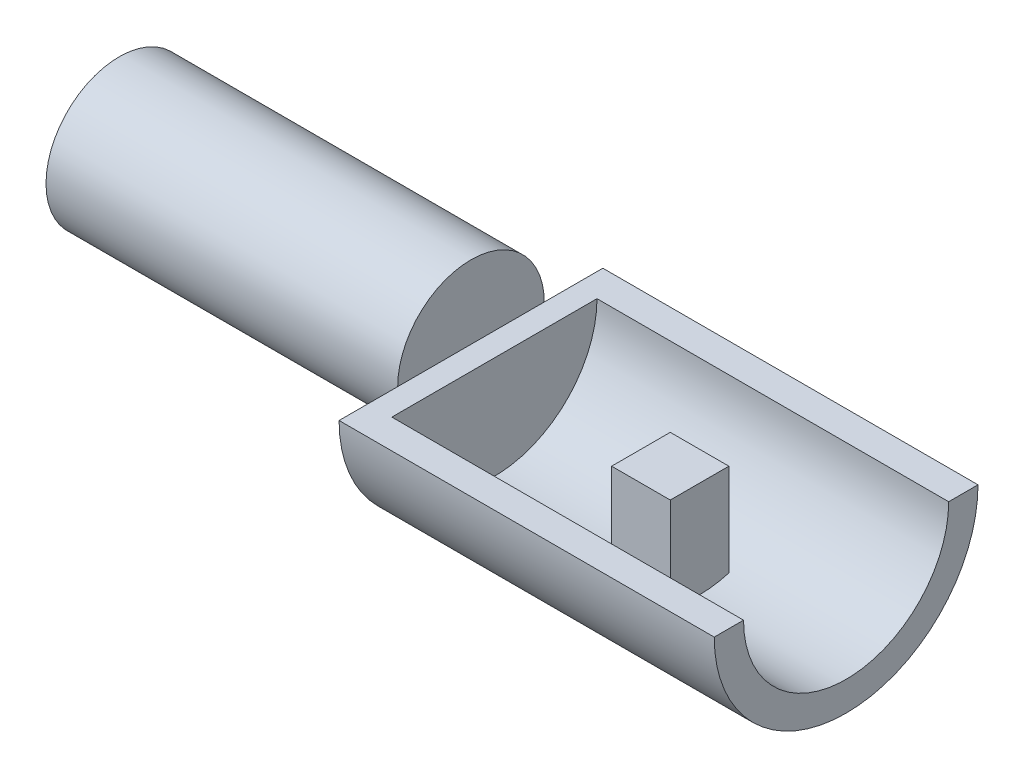
from build123d import *

# Parameters (mm, degrees)
BOSS_EXTRUDE1_DEPTH      = 30
BOSS_EXTRUDE1_DEPTH_BACK = 30
BOSS_EXTRUDE2_REACH      = 46.732
BOSS_EXTRUDE2_END_RADIUS = 17.5
BOSS_EXTRUDE2_START      = -1
SKETCH3_W                = 10
SKETCH3_H                = 10
BOSS_EXTRUDE3_START      = 4
BOSS_EXTRUDE3_DEPTH      = 4
SKETCH5_R                = 12.5
BOSS_EXTRUDE4_DEPTH      = 60
SKETCH6_R                = 11.5
CUT_EXTRUDE1_DEPTH       = 7


with BuildPart() as part:
    # Sketch1 → Boss-Extrude1 (new, two sides: drawn at the far end of the back side and taken through both)
    with BuildSketch(Plane(origin=(0, 0, 0), x_dir=(0, 0, -1), z_dir=(1, 0, 0)).offset(-BOSS_EXTRUDE1_DEPTH_BACK)):
        with BuildLine():
            Line((-17.5, 0), (-22.5, 0))
            ThreePointArc((-22.5, 0), (0, -22.5), (22.5, 0))
            Line((22.5, 0), (17.5, 0))
            ThreePointArc((17.5, 0), (0, -17.5), (-17.5, 0))
        make_face()
    extrude(amount=BOSS_EXTRUDE1_DEPTH + BOSS_EXTRUDE1_DEPTH_BACK)

    # Boss-Extrude2: up to this cylinder (the profile starts inside it)
    boss_extrude2_end = Plane(origin=(0, 0, 0), z_dir=(1, 0, 0)) * Cylinder(BOSS_EXTRUDE2_END_RADIUS, 129.464, mode=Mode.PRIVATE)
    # Sketch3 → Boss-Extrude2 (add, up to the surface)
    with BuildSketch(Plane(origin=(0, 0, 0), x_dir=(1, 0, 0), z_dir=(0, 1, 0)).offset(BOSS_EXTRUDE2_START), mode=Mode.PRIVATE) as boss_extrude2_sk1:
        Rectangle(SKETCH3_W, SKETCH3_H)
    boss_extrude2_tool1 = extrude(boss_extrude2_sk1.sketch, amount=-BOSS_EXTRUDE2_REACH, mode=Mode.PRIVATE) & boss_extrude2_end
    add(boss_extrude2_tool1.solids().sort_by_distance((0, -1, 0))[0])

    # Sketch4 → Boss-Extrude3 (add)
    with BuildSketch(Plane.ZY.offset(30).offset(BOSS_EXTRUDE3_START)):
        with BuildLine():
            Line((-22.5, 0), (22.5, 0))
            ThreePointArc((22.5, 0), (0, -22.5), (-22.5, 0))
        make_face()
    extrude(amount=-BOSS_EXTRUDE3_DEPTH)

    # Sketch5 → Boss-Extrude4 (add)
    with BuildSketch(Plane.ZY.offset(34)):
        Circle(SKETCH5_R)
    extrude(amount=BOSS_EXTRUDE4_DEPTH)

    # Sketch6 → Cut-Extrude1 (cut)
    with BuildSketch(Plane.ZY.offset(94)):
        Circle(SKETCH6_R)
    extrude(amount=-CUT_EXTRUDE1_DEPTH, mode=Mode.SUBTRACT)


solid = part.part
